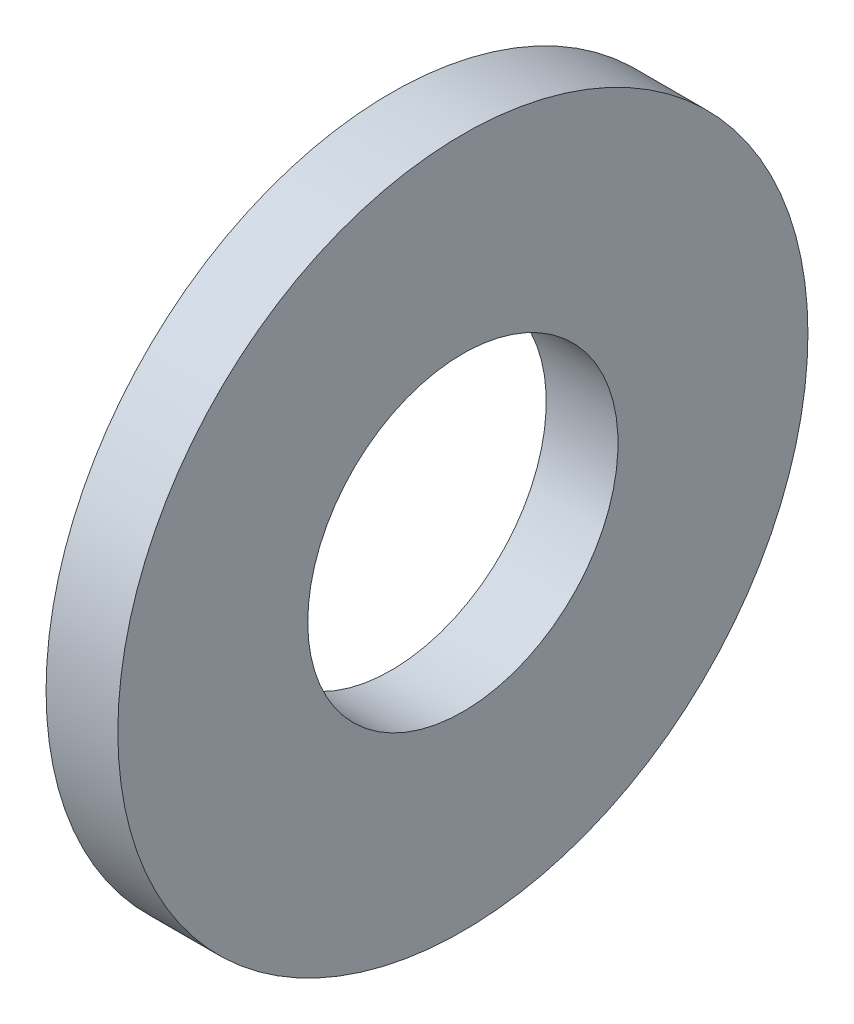
from build123d import *

# Parameters (mm, degrees)
SKETCH1_W = 1.651
SKETCH1_H = 4.3688


with BuildPart() as part:
    # Sketch1 → Revolve1 (revolve)
    with BuildSketch(Plane(origin=(0, 0, 0), x_dir=(-1, 0, 0), z_dir=(0, 0, -1)), mode=Mode.PRIVATE) as revolve1_sk:
        with Locations((0.8255, 5.7531)):
            Rectangle(SKETCH1_W, SKETCH1_H)
    revolve(revolve1_sk.sketch.rotate(Axis((0, 0, 0), (-1, 0, 0)), 270), axis=Axis((0, 0, 0), (-1, 0, 0)))


solid = part.part
